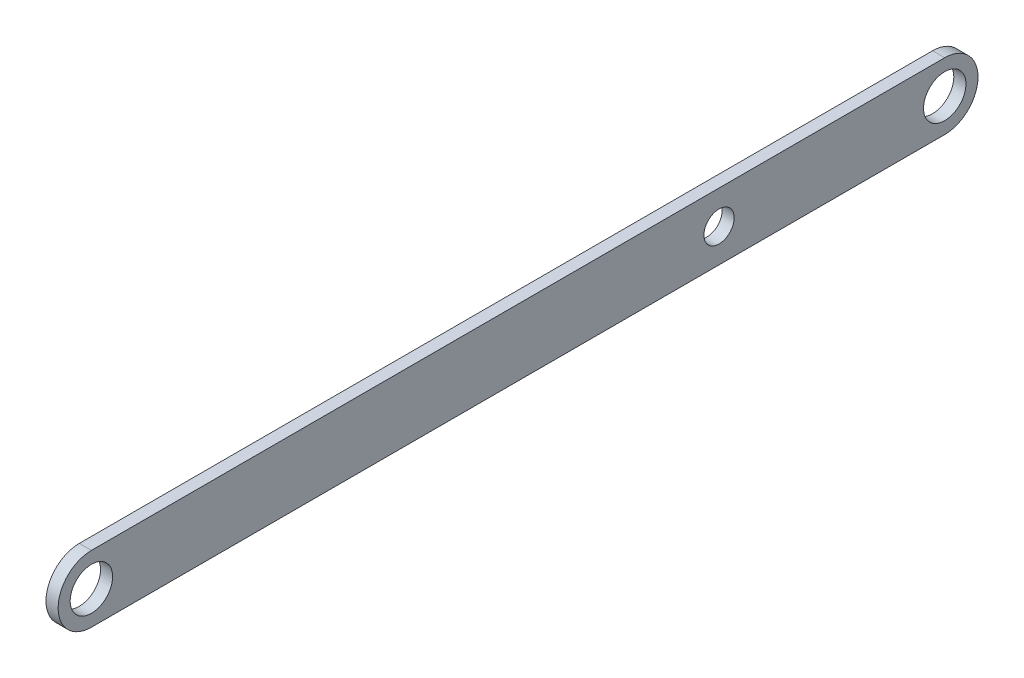
from build123d import *

# Parameters (mm, degrees)
SKETCH2_R           = 7
SKETCH2_R_2         = 5
BOSS_EXTRUDE1_DEPTH = 4


with BuildPart() as part:
    # Sketch2 → Boss-Extrude1 (new body)
    with BuildSketch(Plane(origin=(0, 0, 0), x_dir=(0, 0, -1), z_dir=(1, 0, 0))):
        with BuildLine():
            Line((-77.539483891, 10.986864981), (204.077859883, 10.986864981))
            ThreePointArc((204.077859883, 10.986864981), (215.064724865, 0), (204.077859883, -10.986864981))
            Line((204.077859883, -10.986864981), (-77.539483891, -10.986864981))
            ThreePointArc((-77.539483891, -10.986864981), (-88.526348873, 0), (-77.539483891, 10.986864981))
        make_face()
        with Locations((-77.539483891, 0)):
            Circle(SKETCH2_R, mode=Mode.SUBTRACT)
        with Locations((204.077859883, 0)):
            Circle(SKETCH2_R, mode=Mode.SUBTRACT)
        with Locations((129.598441876, 0)):
            Circle(SKETCH2_R_2, mode=Mode.SUBTRACT)
    extrude(amount=BOSS_EXTRUDE1_DEPTH)


solid = part.part
